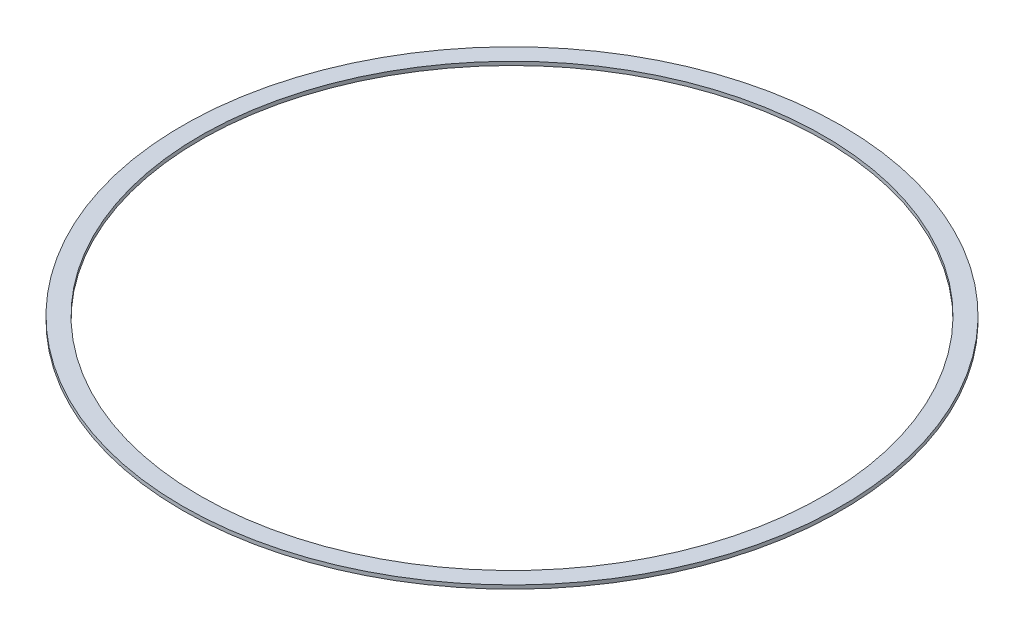
from build123d import *

# Parameters (mm, degrees)
SKETCH1_R           = 226.8601
SKETCH1_R_2         = 214.6681
BOSS_EXTRUDE1_DEPTH = 2.54


with BuildPart() as part:
    # Sketch1 → Boss-Extrude1 (new body)
    with BuildSketch(Plane(origin=(0, 0, 0), x_dir=(1, 0, 0), z_dir=(0, 1, 0))):
        with Locations(Location((0, 0, 0), (0, 0, 270))):
            Circle(SKETCH1_R)
        with Locations(Location((0, 0, 0), (0, 0, 270))):
            Circle(SKETCH1_R_2, mode=Mode.SUBTRACT)
    extrude(amount=BOSS_EXTRUDE1_DEPTH)


solid = part.part
